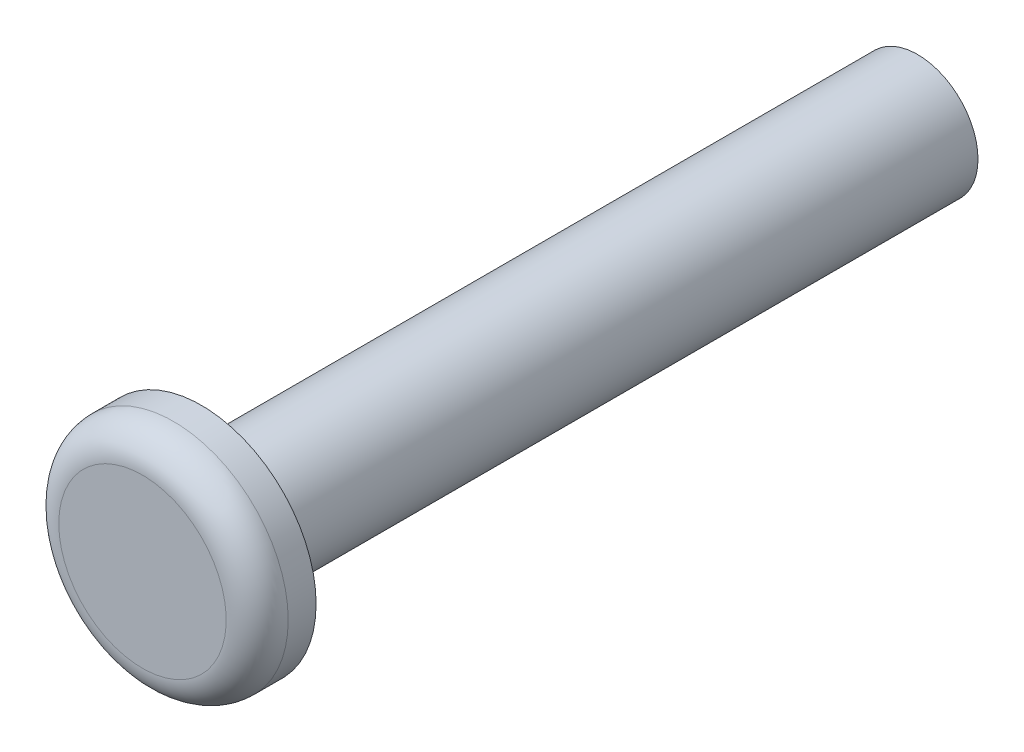
from build123d import *

# Parameters (mm, degrees)
FILLET1_R = 1


with BuildPart() as part:
    # Sketch1 → Revolve1 (revolve)
    with BuildSketch(Plane(origin=(0, 0, 0), x_dir=(0, 0, -1), z_dir=(1, 0, 0)), mode=Mode.PRIVATE) as revolve1_sk:
        Polygon((1.9, 1.95), (1.9, 3.7), (0, 3.7), (0, 0), (25, 0), (25, 1.95), align=None)
    revolve(revolve1_sk.sketch.rotate(Axis((0, 0, 0), (0, 0, -1)), 90), axis=Axis((0, 0, 0), (0, 0, -1)))

    # Fillet1
    fillet1_edges = [part.edges().sort_by_distance(p)[0] for p in [
        (-3.7, 0, 0),
    ]]
    fillet(fillet1_edges, radius=FILLET1_R)


solid = part.part
